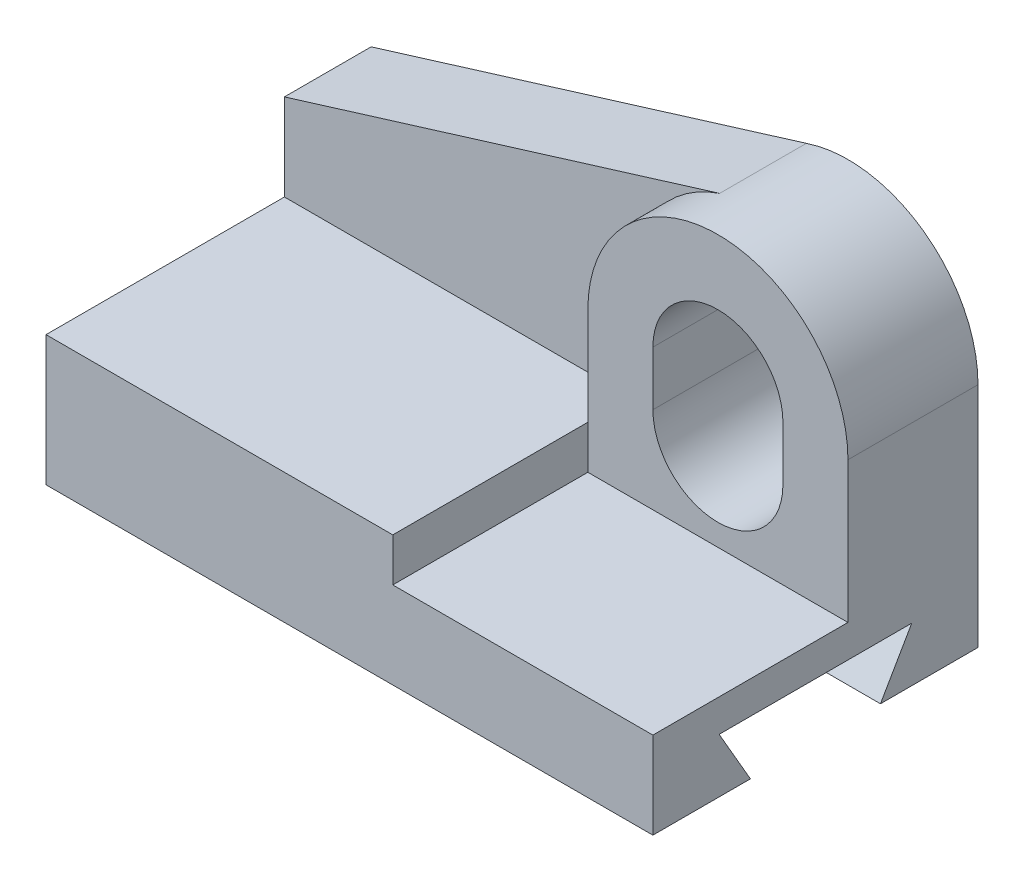
from build123d import *

# Parameters (mm, degrees)
BOSS_EXTRUDE1_DEPTH     = 30
BOSS_EXTRUDE2_DEPTH     = 12
BOSS_EXTRUDE3_DEPTH     = 8
CUT_EXTRUDE1_DEPTH      = 72.589105316
CUT_EXTRUDE1_DEPTH_BACK = 72.589105316


with BuildPart() as part:
    # Sketch2 → Boss-Extrude1 (new body)
    with BuildSketch(Plane.XY):
        Polygon((0, 0), (56, 0), (56, 8), (32, 8), (32, 12), (0, 12), align=None)
    extrude(amount=BOSS_EXTRUDE1_DEPTH)

    # Sketch3 → Boss-Extrude2 (add)
    with BuildSketch(Plane.XY):
        with BuildLine():
            Line((32, 8), (32, 21))
            ThreePointArc((32, 21), (44, 33), (56, 21))
            Line((56, 21), (56, 8))
            Line((56, 8), (32, 8))
        make_face()
        with BuildLine():
            Line((50, 21), (50, 16))
            ThreePointArc((50, 16), (44, 10), (38, 16))
            Line((38, 16), (38, 21))
            ThreePointArc((38, 21), (44, 27), (50, 21))
        make_face(mode=Mode.SUBTRACT)
    extrude(amount=BOSS_EXTRUDE2_DEPTH)

    # Sketch4 → Boss-Extrude3 (add)
    with BuildSketch(Plane.XY):
        with BuildLine():
            Line((0, 20), (0, 12))
            Line((0, 12), (32, 12))
            Line((32, 12), (32, 21))
            ThreePointArc((32, 21), (34.251977355, 27.998289399), (40.162675751, 32.369913923))
            Line((40.162675751, 32.369913923), (0, 20))
        make_face()
    extrude(amount=BOSS_EXTRUDE3_DEPTH)

    # Sketch5 → Cut-Extrude1 (cut, two sides: drawn at the far end of the back side and taken through both)
    with BuildSketch(Plane.ZY.offset(-CUT_EXTRUDE1_DEPTH_BACK)):
        Polygon((9, 0), (21, 0), (23.886751346, 5), (6.113248654, 5), align=None)
    extrude(amount=CUT_EXTRUDE1_DEPTH + CUT_EXTRUDE1_DEPTH_BACK, mode=Mode.SUBTRACT)


solid = part.part
